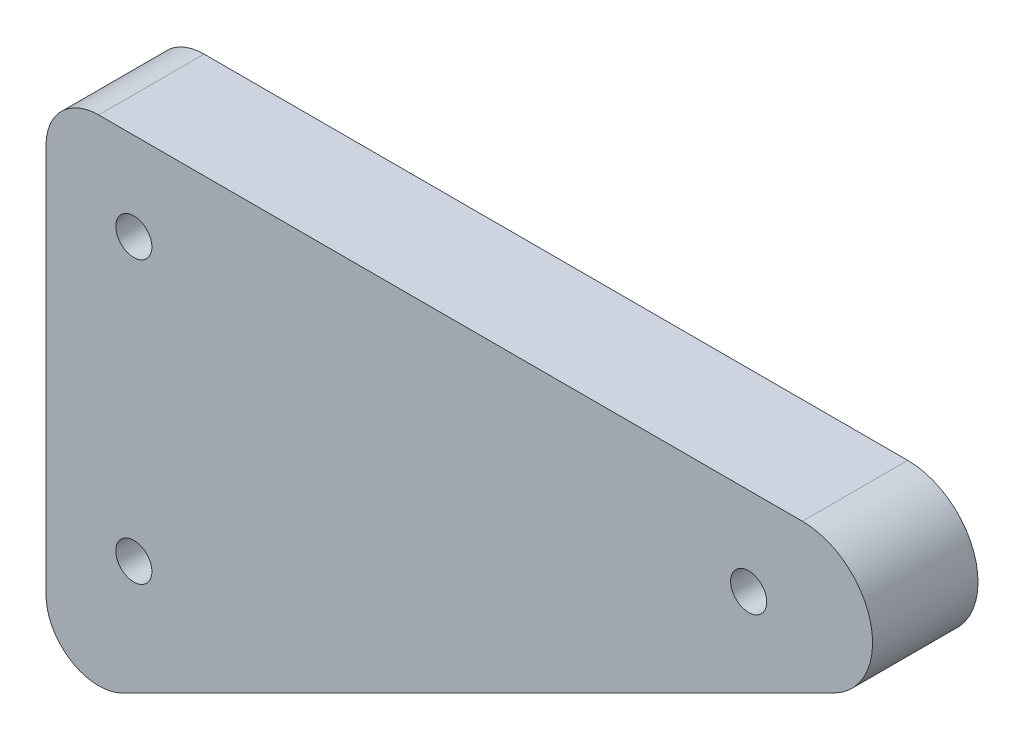
from build123d import *

# Parameters (mm, degrees)
BOSS_EXTRUDE1_DEPTH       = 4.7625
F_4_CLEARANCE_HOLE1_D     = 3.2639
F_4_CLEARANCE_HOLE1_DEPTH = 12.7
F_4_CLEARANCE_HOLE1_TIP   = 0.980574487
FILLET1_R                 = 4.7625
FILLET2_R                 = 6.35


with BuildPart() as part:
    # Sketch1 → Boss-Extrude1 (new, symmetric)
    with BuildSketch(Plane.XY):
        Polygon((0, 0), (0, -47.625), (95.25, 0), align=None)
    extrude(amount=BOSS_EXTRUDE1_DEPTH, both=True)

    # #4 Clearance Hole1
    with Locations(Plane.XY.offset(4.7625)):
        with Locations((7.9375, -7.9375), (63.5, -7.9375), (7.9375, -33.3375)):
            Hole(F_4_CLEARANCE_HOLE1_D / 2, depth=F_4_CLEARANCE_HOLE1_DEPTH)
            with Locations((0, 0, -(F_4_CLEARANCE_HOLE1_DEPTH + F_4_CLEARANCE_HOLE1_TIP / 2))):  # 118° drill point
                Cone(0, F_4_CLEARANCE_HOLE1_D / 2, F_4_CLEARANCE_HOLE1_TIP, mode=Mode.SUBTRACT)

    # Fillet1
    fillet1_edges = [part.edges().sort_by_distance(p)[0] for p in [
        (0, -47.625, 0),
        (0, 0, 0),
    ]]
    fillet(fillet1_edges, radius=FILLET1_R)

    # Fillet2
    fillet2_edges = [part.edges().sort_by_distance(p)[0] for p in [
        (95.25, 0, 0),
    ]]
    fillet(fillet2_edges, radius=FILLET2_R)


solid = part.part
